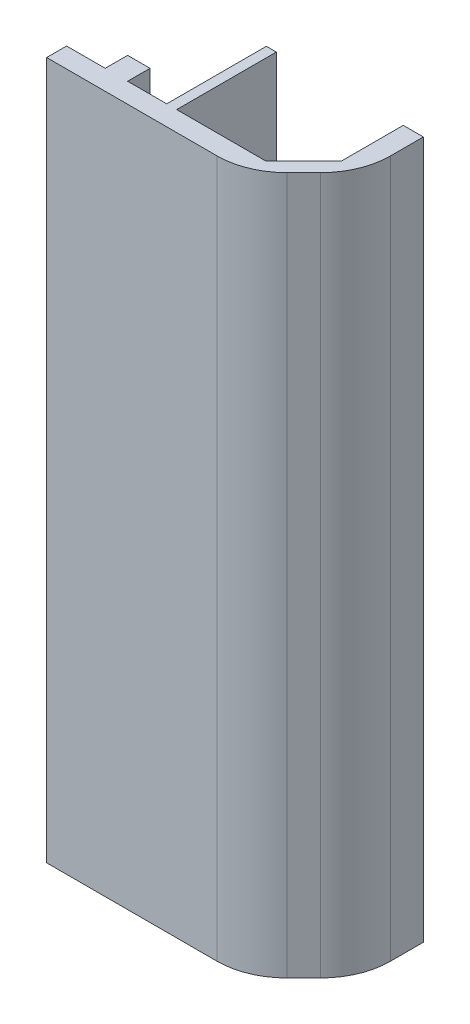
from build123d import *

# Parameters (mm, degrees)
EXTRUDE_1_DEPTH = 140
FILLET_1_R      = 14
SKETCH_2_W      = 2
SKETCH_2_H      = 140
EXTRUDE_2_DEPTH = 20


with BuildPart() as part:
    # 草圖1 → 填料-伸長1 (new body)
    with BuildSketch(Plane(origin=(0, 0, 0), x_dir=(1, 0, 0), z_dir=(0, 1, 0))):
        Polygon((-27.501723192, 6.859259259), (-23.001723192, 6.859259259), (-23.001723192, 2.359259259), (4.748276808, 2.359259259), (12.331610141, 9.942592593), (12.331610141, 22.359259259), (16.361610141, 22.359259259), (16.361610141, 9.942592593), (4.778276808, -1.640740741), (-35.251723192, -1.640740741), (-35.251723192, 2.359259259), (-27.501723192, 2.359259259), align=None)
    extrude(amount=EXTRUDE_1_DEPTH)

    # 圓角1
    fillet_1_edges = [part.edges().sort_by_distance(p)[0] for p in [
        (16.361610141, 70, -9.942592593),
        (4.778276808, 70, 1.640740741),
    ]]
    fillet(fillet_1_edges, radius=FILLET_1_R)

    # 草圖2 → 填料-伸長2 (add)
    with BuildSketch(Plane(origin=(0, 0, -2.359259259), x_dir=(-1, 0, 0), z_dir=(0, 0, -1))):
        with Locations((14.151723192, 70)):
            Rectangle(SKETCH_2_W, SKETCH_2_H)
    extrude(amount=EXTRUDE_2_DEPTH)


solid = part.part
